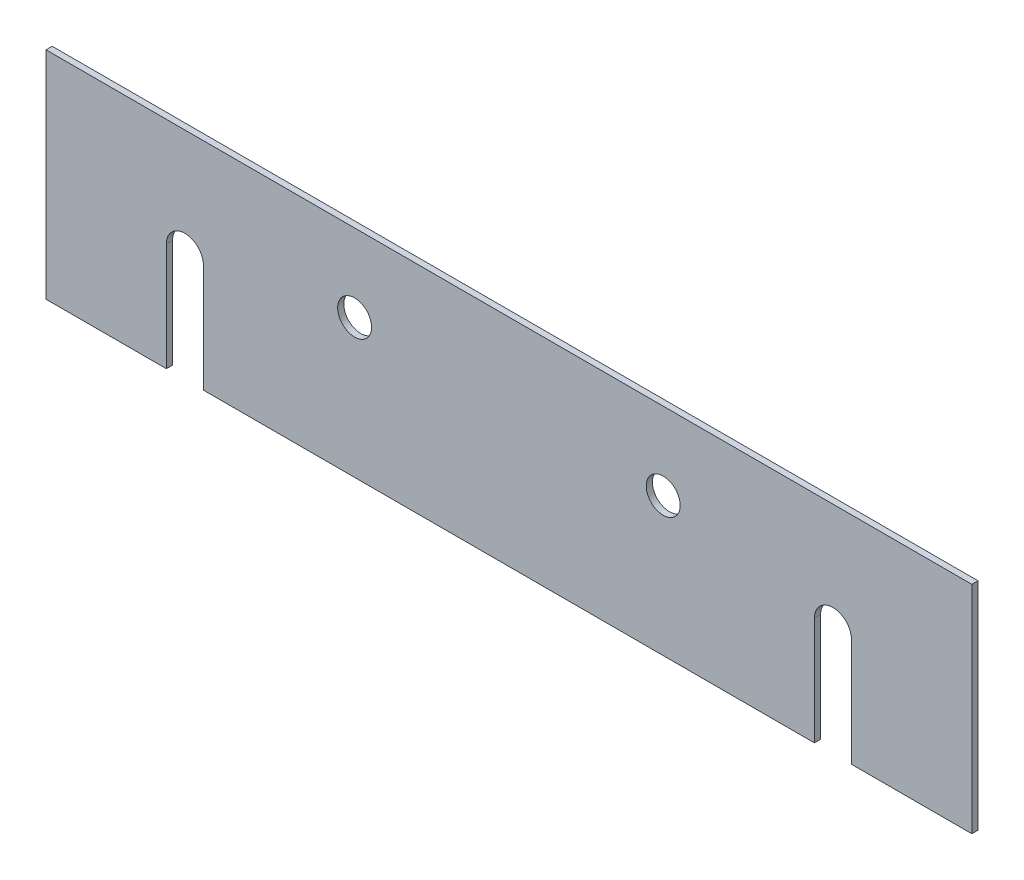
from build123d import *

# Parameters (mm, degrees)
SKETCH1_R           = 5.5
BOSS_EXTRUDE1_DEPTH = 2


with BuildPart() as part:
    # Sketch1 → Boss-Extrude1 (new body)
    with BuildSketch(Plane.XY):
        with BuildLine():
            Line((103.180041152, 46.419753086), (-196.819958848, 46.419753086))
            Line((-196.819958848, 46.419753086), (-196.819958848, -23.580246914))
            Line((-196.819958848, -23.580246914), (-157.819958848, -23.580246914))
            Line((-157.819958848, -23.580246914), (-157.819958848, 11.419753086))
            ThreePointArc((-157.819958848, 11.419753086), (-151.819958848, 17.419753086), (-145.819958848, 11.419753086))
            Line((-145.819958848, 11.419753086), (-145.819958848, -23.580246914))
            Line((-145.819958848, -23.580246914), (52.180041152, -23.580246914))
            Line((52.180041152, -23.580246914), (52.180041152, 11.419753086))
            ThreePointArc((52.180041152, 11.419753086), (58.180041152, 17.419753086), (64.180041152, 11.419753086))
            Line((64.180041152, 11.419753086), (64.180041152, -23.580246914))
            Line((64.180041152, -23.580246914), (103.180041152, -23.580246914))
            Line((103.180041152, -23.580246914), (103.180041152, 46.419753086))
        make_face()
        with Locations((-96.819958848, 21.296296296)):
            Circle(SKETCH1_R, mode=Mode.SUBTRACT)
        with Locations((3.180041152, 21.296296296)):
            Circle(SKETCH1_R, mode=Mode.SUBTRACT)
    extrude(amount=BOSS_EXTRUDE1_DEPTH)


solid = part.part
